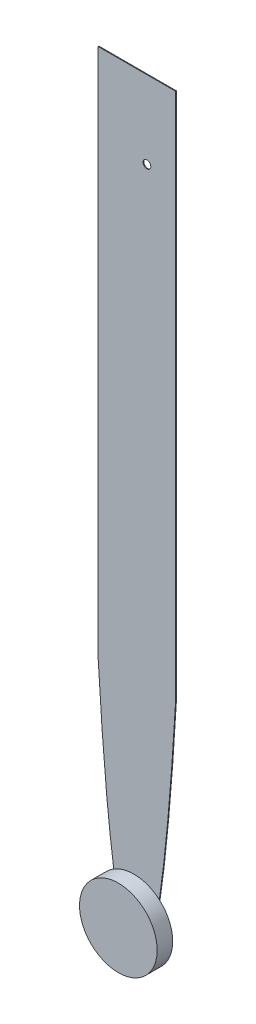
from build123d import *

# Parameters (mm, degrees)
RESSALTO_EXTRUS_O1_DEPTH = 0.1
ESBO_O2_R                = 5
RESSALTO_EXTRUS_O2_DEPTH = 2
ESBO_O3_R                = 0.5
CORTE_EXTRUS_O1_DEPTH    = 10


with BuildPart() as part:
    # Esboço1 → Ressalto-extrusão1 (new body)
    with BuildSketch(Plane.XY):
        with BuildLine():
            Line((-4.617998397, 68.674835442), (5.382001603, 68.674835442))
            Line((5.382001603, 68.674835442), (5.382001603, 0.729621909))
            add(Edge.make_bspline(
                [(5.382001603, 0.729621909), (4.210394845, -19.422014325), (2.511565046, -31.255242579), (0.382001603, -31.325164558)],
                knots=[0, 0, 0, 0, 1, 1, 1, 1], degree=3))
            add(Edge.make_bspline(
                [(-4.617998397, 0.729621909), (-3.446391639, -19.422014325), (-1.747561841, -31.255242579), (0.382001603, -31.325164558)],
                knots=[0, 0, 0, 0, 1, 1, 1, 1], degree=3))
            Line((-4.617998397, 0.729621909), (-4.617998397, 68.674835442))
        make_face()
    extrude(amount=RESSALTO_EXTRUS_O1_DEPTH)

    # Esboço2 → Ressalto-extrusão2 (add)
    with BuildSketch(Plane.XY.offset(0.1)):
        with Locations(Location((0, -26.325164558, 0), (0, 0, 121.235952795))):
            Circle(ESBO_O2_R)
    extrude(amount=RESSALTO_EXTRUS_O2_DEPTH)

    # Esboço3 → Corte-extrusão1 (cut)
    with BuildSketch(Plane.XY.offset(0.1)):
        with Locations((1.682001603, 58.674835442)):
            Circle(ESBO_O3_R)
    extrude(amount=-CORTE_EXTRUS_O1_DEPTH, mode=Mode.SUBTRACT)


solid = part.part
